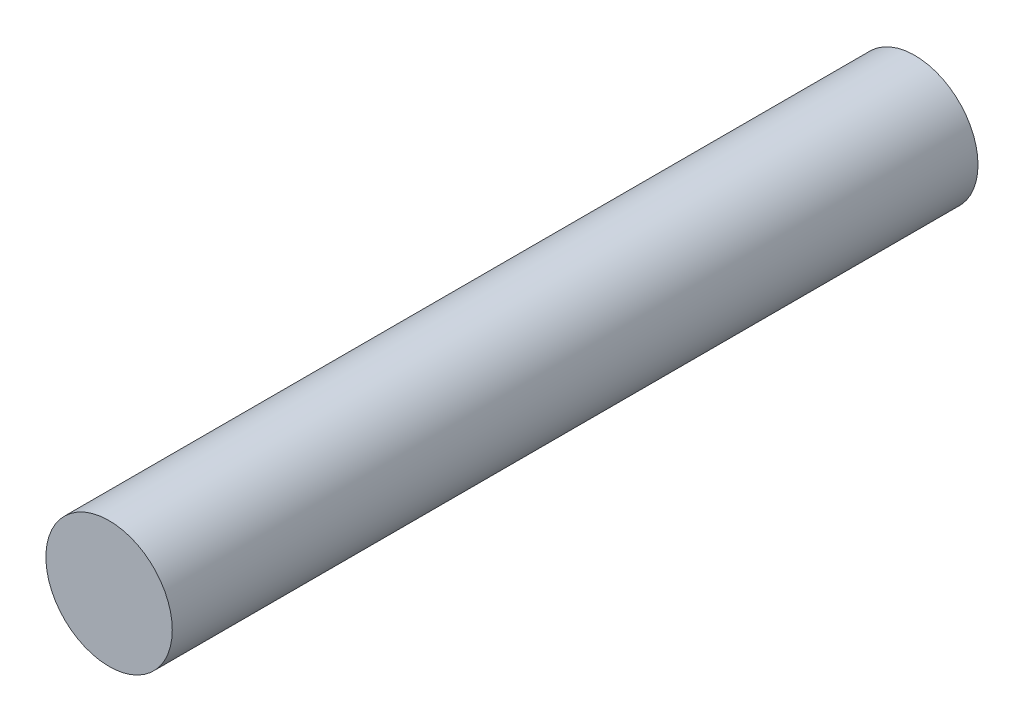
from build123d import *

# Parameters (mm, degrees)
SKETCH1_R           = 4
BOSS_EXTRUDE1_DEPTH = 51


with BuildPart() as part:
    # Sketch1 → Boss-Extrude1 (new body)
    with BuildSketch(Plane.XY):
        Circle(SKETCH1_R)
    extrude(amount=BOSS_EXTRUDE1_DEPTH)


solid = part.part
